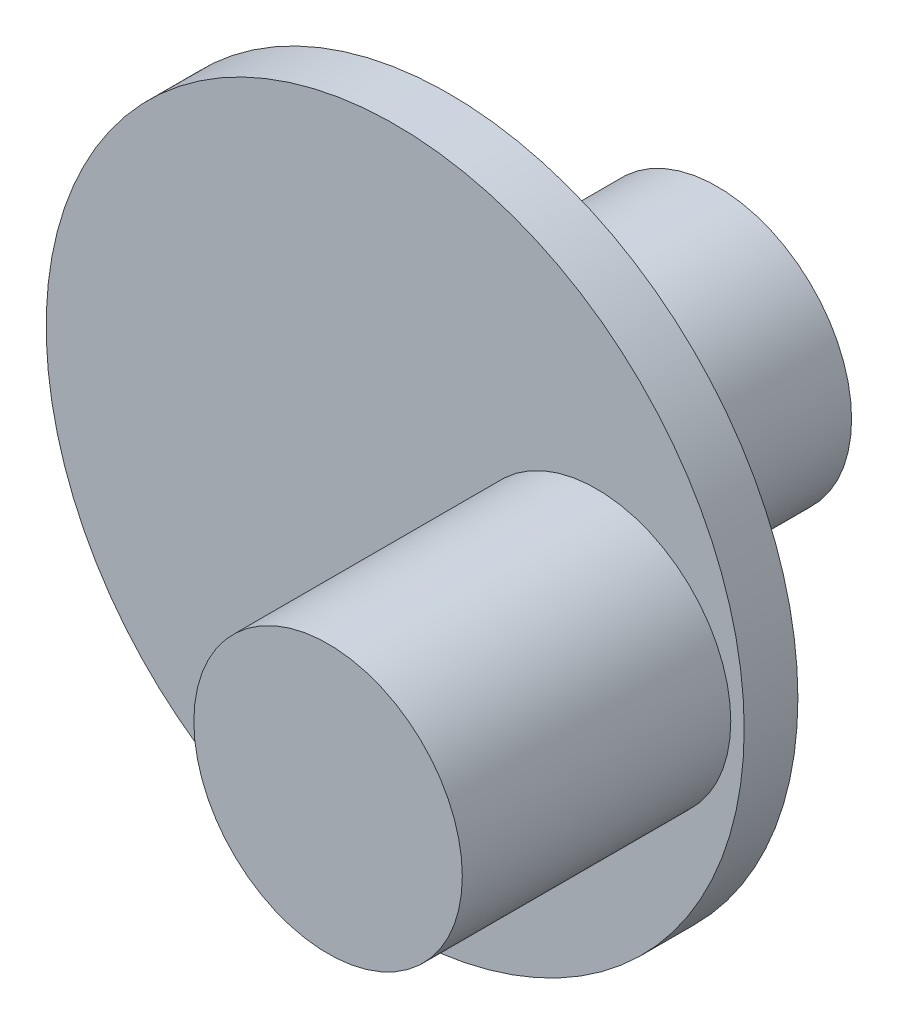
from build123d import *

# Parameters (mm, degrees)
ESQUISSE1_R        = 5
BOSS_EXTRU_1_DEPTH = 10
ESQUISSE2_R        = 13
BOSS_EXTRU_2_DEPTH = 2
ESQUISSE3_R        = 5
BOSS_EXTRU_3_DEPTH = 10


with BuildPart() as part:
    # Esquisse1 → Boss.-Extru.1 (new body)
    with BuildSketch(Plane.XY):
        Circle(ESQUISSE1_R)
    extrude(amount=BOSS_EXTRU_1_DEPTH)

    # Esquisse2 → Boss.-Extru.2 (add)
    with BuildSketch(Plane.XY.offset(10)):
        Circle(ESQUISSE2_R)
    extrude(amount=BOSS_EXTRU_2_DEPTH)

    # Esquisse3 → Boss.-Extru.3 (add)
    with BuildSketch(Plane.XY.offset(12)):
        with Locations((7.5, 0)):
            Circle(ESQUISSE3_R)
    extrude(amount=BOSS_EXTRU_3_DEPTH)


solid = part.part
